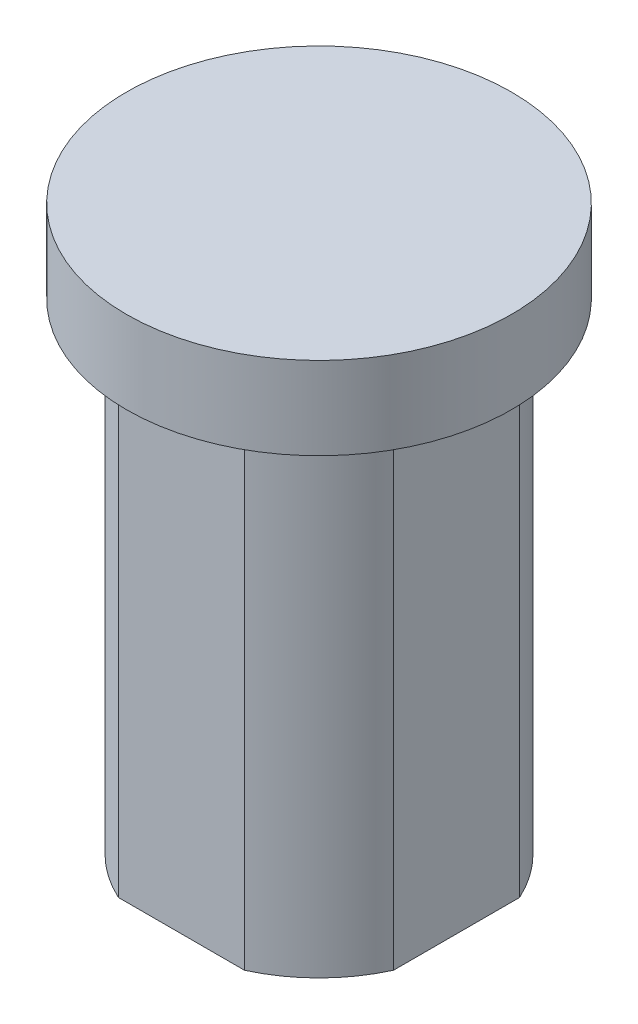
from build123d import *

# Parameters (mm, degrees)
EXTRUDE_1_DEPTH = 35
SKETCH_2_R      = 14
EXTRUDE_2_DEPTH = 6


with BuildPart() as part:
    # 草图1 → 凸台-拉伸1 (new body)
    with BuildSketch(Plane(origin=(0, 0, 0), x_dir=(1, 0, 0), z_dir=(0, 1, 0))):
        with BuildLine():
            Line((4.582575695, -10), (-4.582575695, -10))
            ThreePointArc((-4.582575695, -10), (-7.778174593, -7.778174593), (-10, -4.582575695))
            Line((-10, -4.582575695), (-10, 4.582575695))
            ThreePointArc((-10, 4.582575695), (-7.778174593, 7.778174593), (-4.582575695, 10))
            Line((-4.582575695, 10), (4.582575695, 10))
            ThreePointArc((4.582575695, 10), (7.778174593, 7.778174593), (10, 4.582575695))
            Line((10, 4.582575695), (10, -4.582575695))
            ThreePointArc((10, -4.582575695), (7.778174593, -7.778174593), (4.582575695, -10))
        make_face()
    extrude(amount=EXTRUDE_1_DEPTH)

    # 草图2 → 凸台-拉伸2 (add)
    with BuildSketch(Plane(origin=(0, 35, 0), x_dir=(1, 0, 0), z_dir=(0, 1, 0))):
        with Locations(Location((0, 0, 0), (0, 0, 270))):
            Circle(SKETCH_2_R)
    extrude(amount=EXTRUDE_2_DEPTH)


solid = part.part
